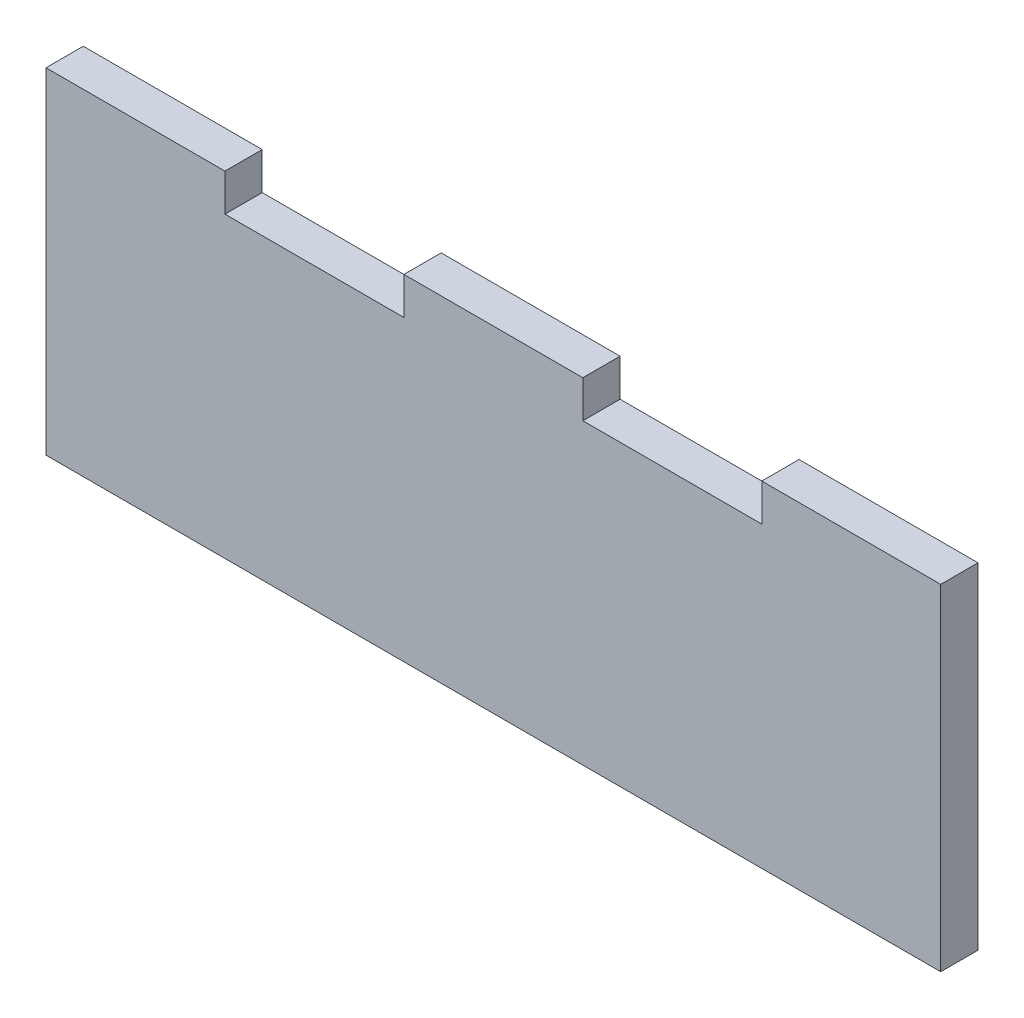
from build123d import *

# Parameters (mm, degrees)
BOSS_EXTRUDE1_DEPTH = 6.35


with BuildPart() as part:
    # Sketch2 → Boss-Extrude1 (new body)
    with BuildSketch(Plane.XY):
        Polygon((0, 0), (152.4, 0), (152.4, 57.15), (121.92, 57.15), (121.92, 50.8), (91.44, 50.8), (91.44, 57.15), (60.96, 57.15), (60.96, 50.8), (30.48, 50.8), (30.48, 57.15), (0, 57.15), align=None)
    extrude(amount=BOSS_EXTRUDE1_DEPTH)


solid = part.part
